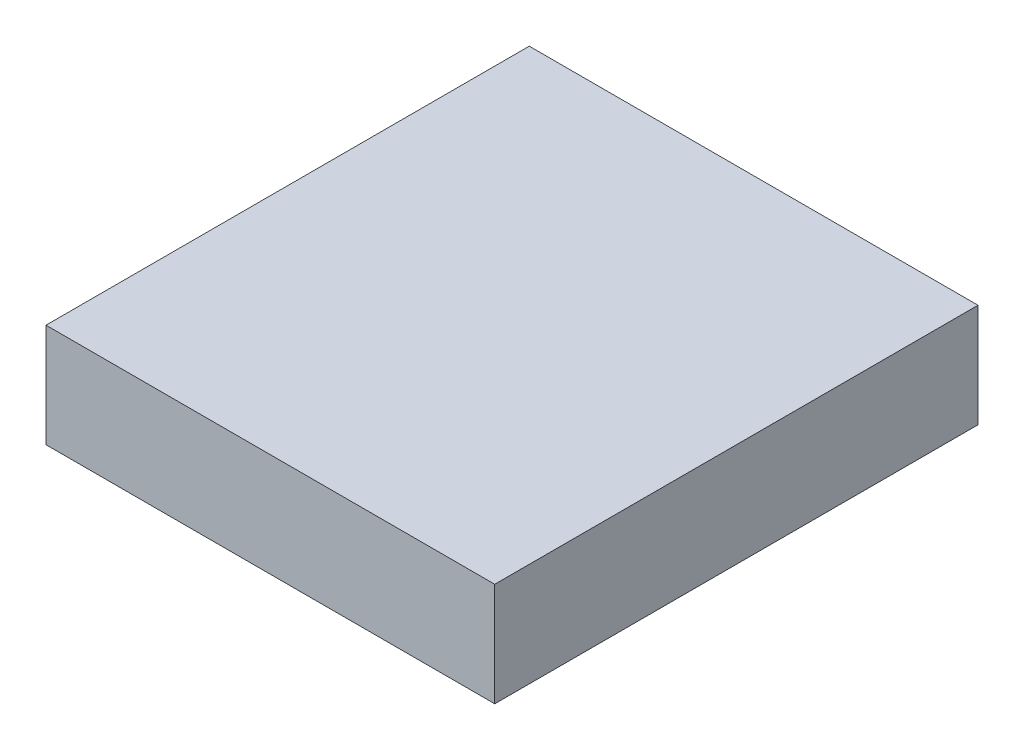
from build123d import *

# Parameters (mm, degrees)
SKETCH1_W           = 82.55
SKETCH1_H           = 88.9
BOSS_EXTRUDE1_DEPTH = 19.05


with BuildPart() as part:
    # Sketch1 → Boss-Extrude1 (new body)
    with BuildSketch(Plane(origin=(0, 0, 0), x_dir=(1, 0, 0), z_dir=(0, 1, 0))):
        Rectangle(SKETCH1_W, SKETCH1_H)
    extrude(amount=BOSS_EXTRUDE1_DEPTH)


solid = part.part
